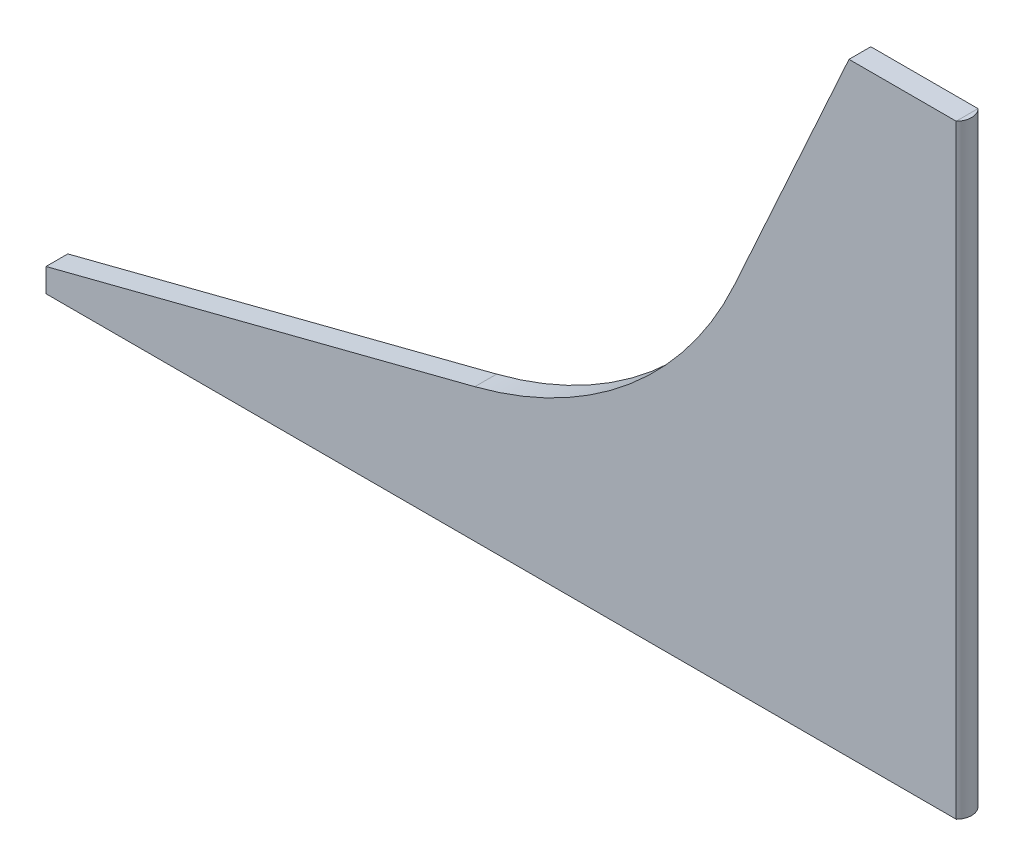
from build123d import *

# Parameters (mm, degrees)
BOSS_EXTRUDE1_DEPTH      = 15
SCALE1_SCALE             = 0.6
BOSS_EXTRUDE3_DEPTH      = 119.026868
BOSS_EXTRUDE3_DEPTH_BACK = 130.573132


with BuildPart() as part:
    # Sketch1 → Boss-Extrude1 (new body)
    with BuildSketch(Plane.XY):
        with BuildLine():
            Line((-236.729376996, 0), (0, 0))
            Line((0, 0), (389.585255443, 0))
            Line((389.585255443, 0), (389.585255443, 416))
            Line((389.585255443, 416), (315.832809595, 416))
            Line((315.832809595, 416), (236.983089551, 242.144494596))
            ThreePointArc((236.983089551, 242.144494596), (164.696190822, 146.877858304), (58.352308735, 92.177707838))
            Line((58.352308735, 92.177707838), (-236.729376996, 16.274880501))
            Line((-236.729376996, 16.274880501), (-236.729376996, 0))
        make_face()
    extrude(amount=BOSS_EXTRUDE1_DEPTH)


with BuildPart() as part_1:
    # Scale1: scaled about (217.356894213, 134.817169742, 7.5)
    add(part.part.scale(SCALE1_SCALE).moved(Location((86.942757685, 53.926867897, 3))))


with BuildPart() as body_2:
    # Sketch3 → Boss-Extrude3 (new, two sides: drawn at the far end of the back side and taken through both)
    with BuildSketch(Plane(origin=(0, 184.5, 0), x_dir=(1, 0, 0), z_dir=(0, 1, 0)).offset(-BOSS_EXTRUDE3_DEPTH_BACK)):
        with BuildLine():
            Line((320.693910951, -3), (320.693910951, -12))
            ThreePointArc((320.693910951, -12), (322.557871982, -7.5), (320.693910951, -3))
        make_face()
    extrude(amount=BOSS_EXTRUDE3_DEPTH + BOSS_EXTRUDE3_DEPTH_BACK)


solid = Compound([part_1.part, body_2.part])
